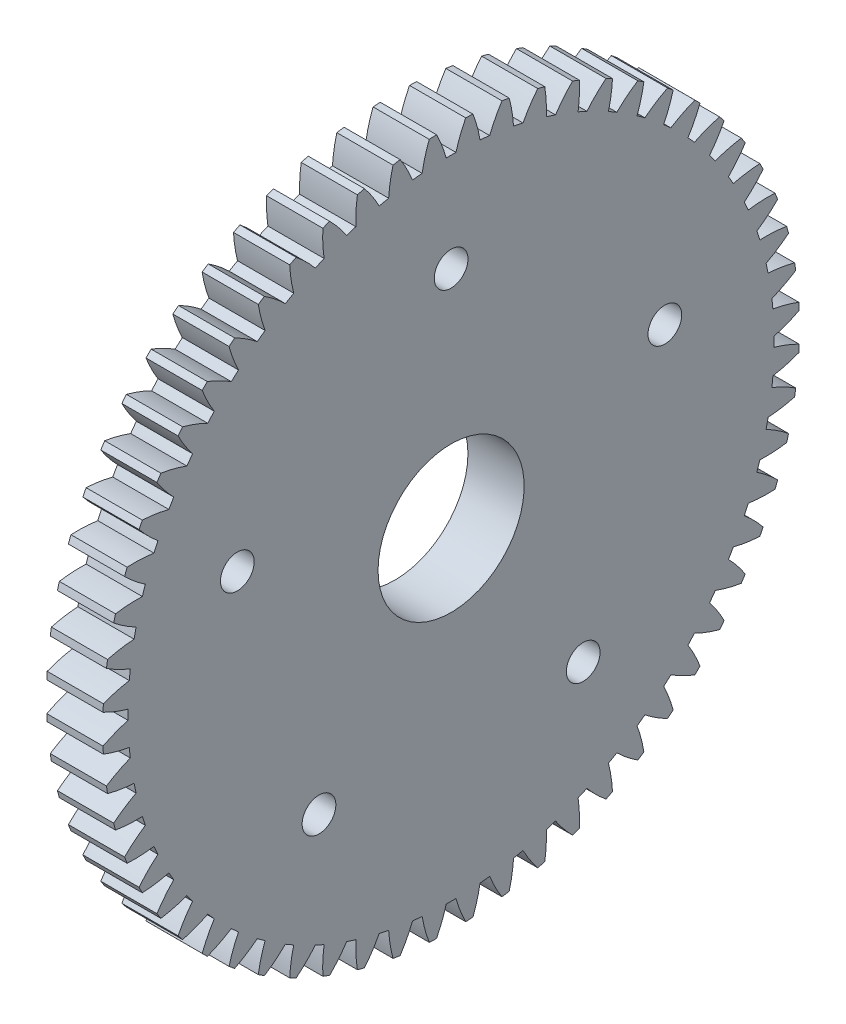
from build123d import *

# Parameters (mm, degrees)
BASPROSKE_W         = 5
BASPROSKE_H         = 31
TOOTHCUT_DEPTH      = 45.124822946
TEETHCUTS_COUNT     = 60
BORSKE_R            = 6.5
BORE_DEPTH          = 50.0000508
SKETCH_1_R          = 1.5
CUT_EXTRUDE_2_DEPTH = 5


with BuildPart() as part:
    # BasProSke → Base-Revolve (revolve)
    with BuildSketch(Plane(origin=(0, 0, 0), x_dir=(1, 0, 0), z_dir=(0, 1, 0)), mode=Mode.PRIVATE) as base_revolve_sk:
        with Locations((2.5, 15.5)):
            Rectangle(BASPROSKE_W, BASPROSKE_H)
    revolve(base_revolve_sk.sketch.rotate(Axis((-10, 0, 0), (1, 0, 0)), 180), axis=Axis((-10, 0, 0), (1, 0, 0)))

    # TooCutSke → ToothCut (cut, through all)
    with BuildSketch(Plane(origin=(0, 0, 0), x_dir=(0, 0, -1), z_dir=(1, 0, 0))):
        with BuildLine():
            ThreePointArc((0.430151971, 28.745781782), (0, 28.749), (-0.430151971, 28.745781782))
            ThreePointArc((-0.430151971, 28.745781782), (-0.81454129, 29.893990802), (-1.312684569, 30.997617721))
            ThreePointArc((-1.312684569, 30.997617721), (0, 31.0254), (1.312684569, 30.997617721))
            ThreePointArc((1.312684569, 30.997617721), (0.81454129, 29.893990802), (0.430151971, 28.745781782))
        make_face()
    toothcut = extrude(amount=TOOTHCUT_DEPTH, mode=Mode.SUBTRACT)

    # TeethCuts: ToothCut ×60 about axis
    teethcuts_axis = Axis((0, 0, 0), (1, 0, 0))
    for i in range(1, TEETHCUTS_COUNT):
        add(toothcut.rotate(teethcuts_axis, i * 360 / TEETHCUTS_COUNT), mode=Mode.SUBTRACT)

    # BorSke → Bore (cut, symmetric)
    with BuildSketch(Plane(origin=(0, 0, 0), x_dir=(0, 0, -1), z_dir=(1, 0, 0))):
        with Locations(Location((0, 0, 0), (0, 0, 180))):
            Circle(BORSKE_R)
    extrude(amount=BORE_DEPTH, both=True, mode=Mode.SUBTRACT)

    # 草图1 → 切除-拉伸2 (cut)
    with BuildSketch(Plane(origin=(5, 0, 0), x_dir=(0, 0, -1), z_dir=(1, 0, 0))):
        with Locations((0, 20)):
            Circle(SKETCH_1_R)
        with Locations((19.021130326, 6.180339887)):
            Circle(SKETCH_1_R)
        with Locations((11.755705046, -16.180339887)):
            Circle(SKETCH_1_R)
        with Locations((-11.755705046, -16.180339887)):
            Circle(SKETCH_1_R)
        with Locations((-19.021130326, 6.180339887)):
            Circle(SKETCH_1_R)
    extrude(amount=-CUT_EXTRUDE_2_DEPTH, mode=Mode.SUBTRACT)


solid = part.part
